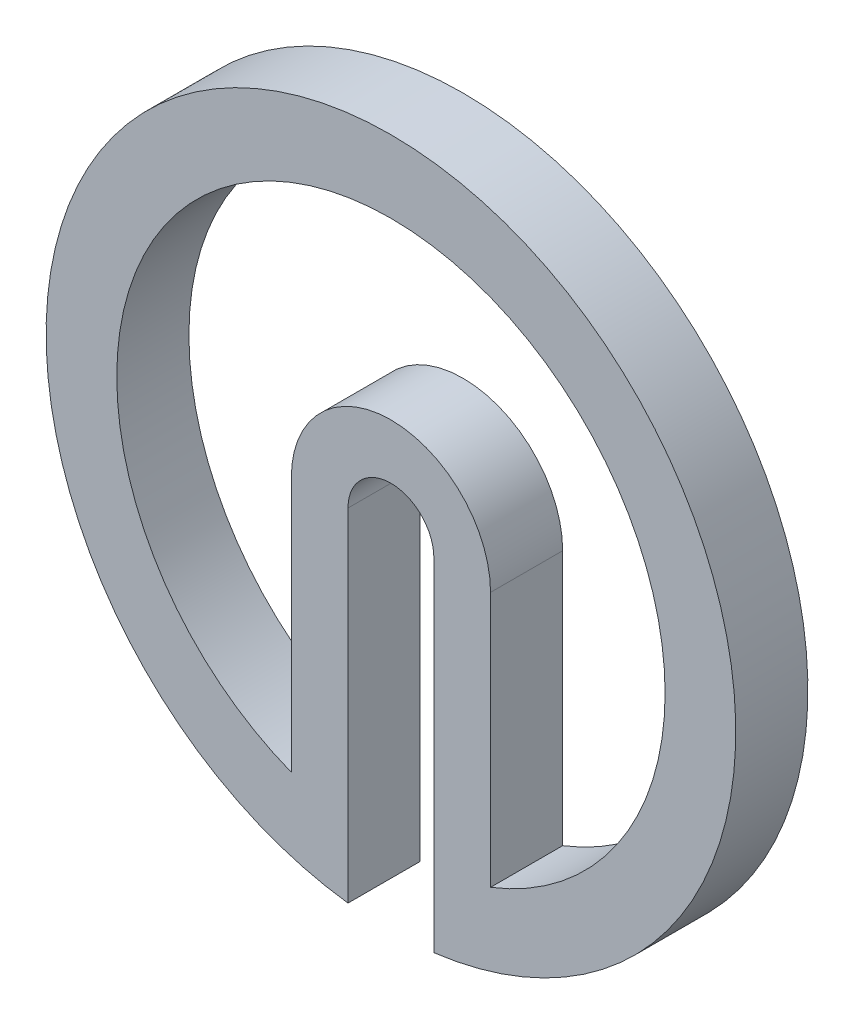
from build123d import *

# Parameters (mm, degrees)
BOSS_EXTRUDE1_DEPTH = 5.334
CUT_EXTRUDE1_DEPTH  = 37.454787834


with BuildPart() as part:
    # Sketch1 → Boss-Extrude1 (new body)
    with BuildSketch(Plane.XY):
        with BuildLine():
            Line((-3.175, 0), (-3.175, -25.301568627))
            ThreePointArc((-3.175, -25.301568627), (0, 25.5), (3.175, -25.301568627))
            Line((3.175, -25.301568627), (3.175, 0))
            ThreePointArc((3.175, 0), (0, 3.175), (-3.175, 0))
        make_face()
    extrude(amount=-BOSS_EXTRUDE1_DEPTH)

    # Sketch3 → Cut-Extrude1 (cut, through all)
    with BuildSketch(Plane.XY):
        with BuildLine():
            Line((-7.365810735, -0.130956725), (-7.365810735, -19.019753779))
            ThreePointArc((-7.365810735, -19.019753779), (0, 20.143209644), (7.365810735, -19.019753779))
            Line((7.365810735, -19.019753779), (7.365810735, -0.130956725))
            ThreePointArc((7.365810735, -0.130956725), (0, 7.23485401), (-7.365810735, -0.130956725))
        make_face()
    extrude(amount=-CUT_EXTRUDE1_DEPTH, mode=Mode.SUBTRACT)


solid = part.part
